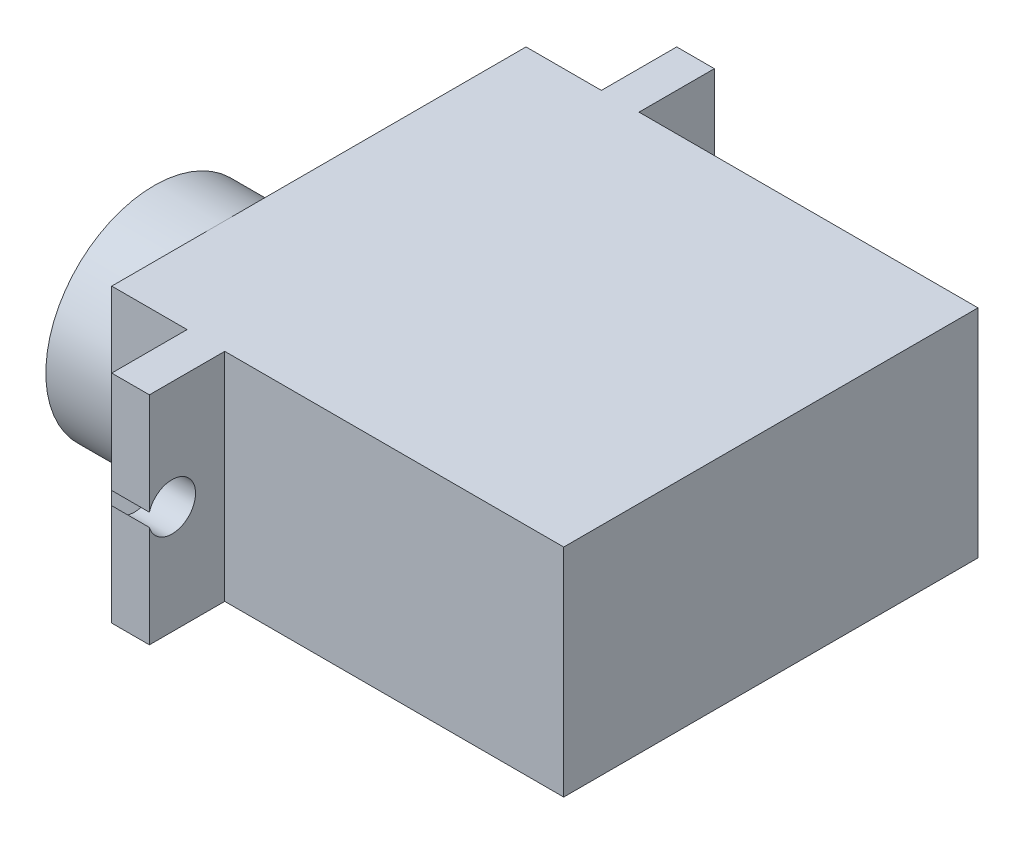
from build123d import *

# Parameters (mm, degrees)
BOSS_EXTRUDE1_DEPTH = 11.5
BOSS_EXTRUDE2_DEPTH = 3.5
SKETCH4_R           = 1.5
BOSS_EXTRUDE3_DEPTH = 3
SKETCH5_R           = 1.25
CUT_EXTRUDE1_DEPTH  = 3.5


with BuildPart() as part:
    # Sketch1 → Boss-Extrude1 (new body)
    with BuildSketch(Plane(origin=(0, 0, 0), x_dir=(1, 0, 0), z_dir=(0, 1, 0))):
        Polygon((-20, 0), (-24, 0), (-24, 22), (-20, 22), (-20, 26), (-18, 26), (-18, 22), (0, 22), (0, 0), (-18, 0), (-18, -4), (-20, -4), align=None)
    extrude(amount=BOSS_EXTRUDE1_DEPTH)

    # Sketch2 → Boss-Extrude2 (add)
    with BuildSketch(Plane.ZY.offset(24)):
        with BuildLine():
            ThreePointArc((-11.140964663, 3.75), (0, 5.75), (-11.140964663, 7.75))
            ThreePointArc((-11.140964663, 7.75), (-13.140964663, 5.75), (-11.140964663, 3.75))
        make_face()
    extrude(amount=BOSS_EXTRUDE2_DEPTH)

    # Sketch4 → Boss-Extrude3 (add)
    with BuildSketch(Plane.ZY.offset(27.5)):
        with Locations((-5.75, 5.75)):
            Circle(SKETCH4_R)
    extrude(amount=BOSS_EXTRUDE3_DEPTH)

    # Sketch5 → Cut-Extrude1 (cut)
    with BuildSketch(Plane.ZY.offset(20)):
        with Locations((-24.8, 5.75)):
            Circle(SKETCH5_R)
        with Locations((2.8, 5.75)):
            Circle(SKETCH5_R)
    extrude(amount=-CUT_EXTRUDE1_DEPTH, mode=Mode.SUBTRACT)


solid = part.part
